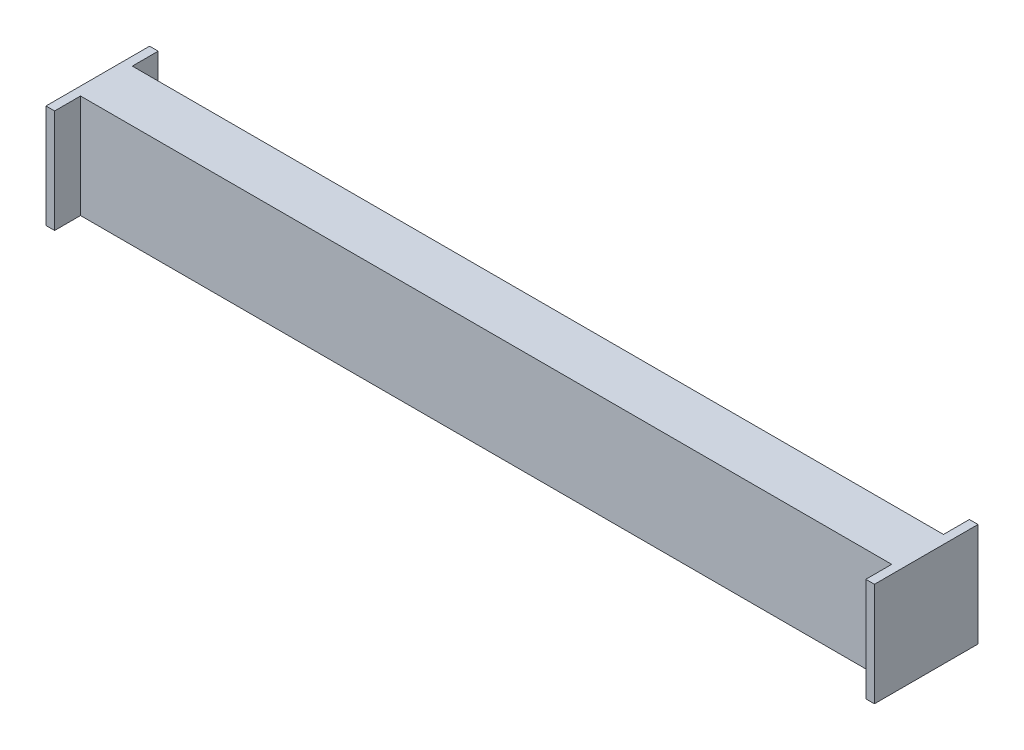
from build123d import *

# Parameters (mm, degrees)
SKETCH1_W           = 76.2
SKETCH1_H           = 152.4
BOSS_EXTRUDE1_DEPTH = 1219.2
SKETCH2_W           = 152.4
SKETCH2_H           = 152.4
BOSS_EXTRUDE2_DEPTH = 12.7
SKETCH3_W           = 152.4
SKETCH3_H           = 152.4
BOSS_EXTRUDE3_DEPTH = 12.7


with BuildPart() as part:
    # Sketch1 → Boss-Extrude1 (new body)
    with BuildSketch(Plane(origin=(0, 0, 0), x_dir=(0, 0, -1), z_dir=(1, 0, 0))):
        Rectangle(SKETCH1_W, SKETCH1_H)
    extrude(amount=BOSS_EXTRUDE1_DEPTH)

    # Sketch2 → Boss-Extrude2 (add)
    with BuildSketch(Plane(origin=(1219.2, 0, 0), x_dir=(0, 0, -1), z_dir=(1, 0, 0))):
        Rectangle(SKETCH2_W, SKETCH2_H)
    extrude(amount=-BOSS_EXTRUDE2_DEPTH)

    # Sketch3 → Boss-Extrude3 (add)
    with BuildSketch(Plane.ZY):
        Rectangle(SKETCH3_W, SKETCH3_H)
    extrude(amount=-BOSS_EXTRUDE3_DEPTH)


solid = part.part
